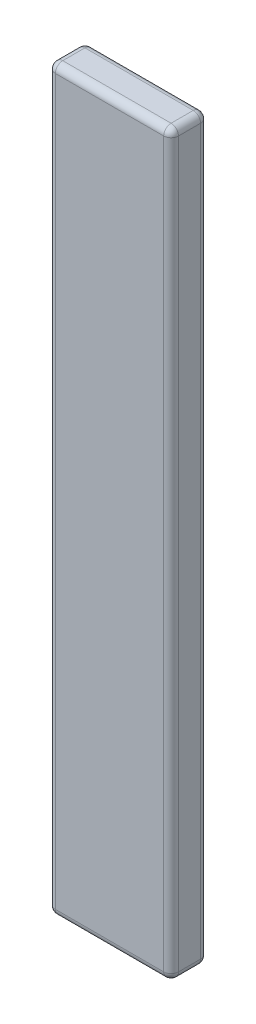
from build123d import *

# Parameters (mm, degrees)
SKIZZE1_W                       = 10
SKIZZE1_H                       = 60
AUFSATZ_LINEAR_AUSTRAGEN1_DEPTH = 3
VERRUNDUNG1_R                   = 0.6


with BuildPart() as part:
    # Skizze1 → Aufsatz-Linear austragen1 (new body)
    with BuildSketch(Plane.XY):
        with Locations((5, -30)):
            Rectangle(SKIZZE1_W, SKIZZE1_H)
    extrude(amount=AUFSATZ_LINEAR_AUSTRAGEN1_DEPTH)

    # Verrundung1
    verrundung1_edges = [part.edges().sort_by_distance(p)[0] for p in [
        (10, -30, 3),
        (5, 0, 3),
        (0, -30, 3),
        (5, 0, 0),
        (10, -30, 0),
        (5, -60, 0),
        (0, -30, 0),
        (0, 0, 1.5),
        (10, 0, 1.5),
        (10, -60, 1.5),
        (0, -60, 1.5),
        (5, -60, 3),
    ]]
    fillet(verrundung1_edges, radius=VERRUNDUNG1_R)


solid = part.part
